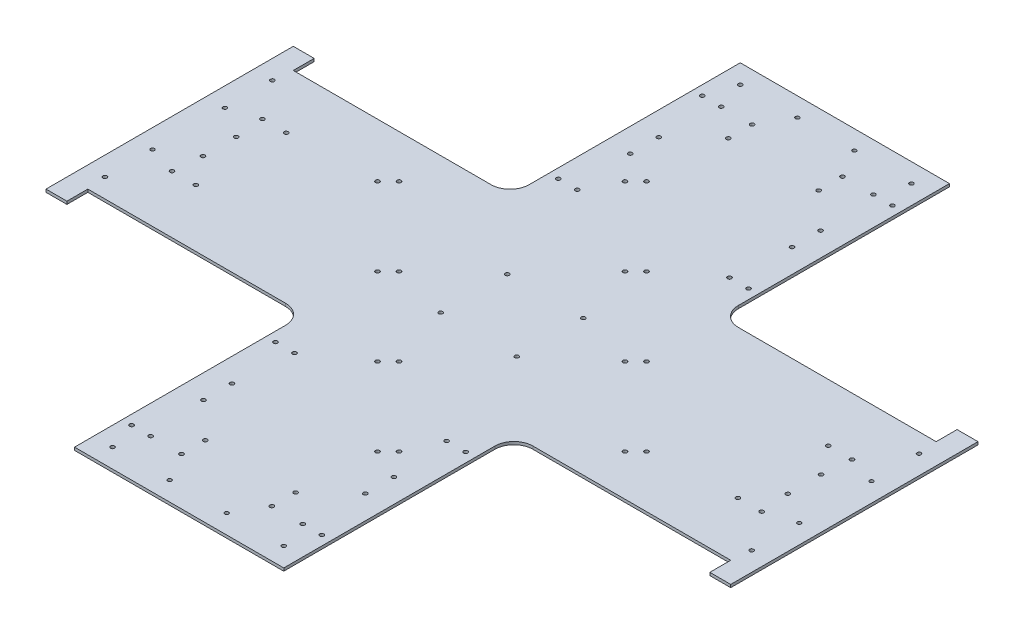
from build123d import *

# Parameters (mm, degrees)
BOSS_EXTRUDE1_DEPTH = 3
SKETCH2_R           = 2.125
CUT_EXTRUDE1_DEPTH  = 503.104570782
SKETCH3_R           = 2
CUT_EXTRUDE2_DEPTH  = 503.104570782
SKETCH5_R           = 2.125
CUT_EXTRUDE4_DEPTH  = 10
FILLET1_R           = 20
SKETCH6_R           = 2.125
CUT_EXTRUDE5_DEPTH  = 503.104570782
SKETCH8_R           = 2.1
CUT_EXTRUDE6_DEPTH  = 10
SKETCH7_R           = 2.1
CUT_EXTRUDE7_DEPTH  = 10


with BuildPart() as part:
    # Sketch1 → Boss-Extrude1 (new body)
    with BuildSketch(Plane(origin=(0, 0, 0), x_dir=(1, 0, 0), z_dir=(0, 1, 0))):
        Polygon((-110, 350), (-110, 108), (-338, 108), (-338, 130), (-360, 130), (-360, -130), (-338, -130), (-338, -108), (-110, -108), (-110, -350), (110, -350), (110, -108), (338, -108), (338, -130), (360, -130), (360, 130), (338, 130), (338, 108), (110, 108), (110, 350), align=None)
    extrude(amount=BOSS_EXTRUDE1_DEPTH)

    # Sketch2 → Cut-Extrude1 (cut, through all)
    with BuildSketch(Plane(origin=(0, 3, 0), x_dir=(1, 0, 0), z_dir=(0, 1, 0))):
        with Locations(Location((310, 47.5, 0), (0, 0, 270))):
            Circle(SKETCH2_R)
        with Locations(Location((285, 47.5, 0), (0, 0, 270))):
            Circle(SKETCH2_R)
        with Locations(Location((307.5, 17.5, 0), (0, 0, 270))):
            Circle(SKETCH2_R)
        with Locations(Location((307.5, -17.5, 0), (0, 0, 270))):
            Circle(SKETCH2_R)
        with Locations(Location((310, -47.5, 0), (0, 0, 270))):
            Circle(SKETCH2_R)
        with Locations(Location((285, -47.5, 0), (0, 0, 270))):
            Circle(SKETCH2_R)
        with Locations(Location((-285, -47.5, 0), (0, 0, 90))):
            Circle(SKETCH2_R)
        with Locations(Location((-310, -47.5, 0), (0, 0, 90))):
            Circle(SKETCH2_R)
        with Locations(Location((-307.5, -17.5, 0), (0, 0, 90))):
            Circle(SKETCH2_R)
        with Locations(Location((-307.5, 17.5, 0), (0, 0, 90))):
            Circle(SKETCH2_R)
        with Locations(Location((-285, 47.5, 0), (0, 0, 90))):
            Circle(SKETCH2_R)
        with Locations(Location((-310, 47.5, 0), (0, 0, 90))):
            Circle(SKETCH2_R)
        with Locations(Location((47.5, 300, 0), (0, 0, 270))):
            Circle(SKETCH2_R)
        with Locations(Location((47.5, 275, 0), (0, 0, 270))):
            Circle(SKETCH2_R)
        with Locations(Location((-47.5, 275, 0), (0, 0, 90))):
            Circle(SKETCH2_R)
        with Locations(Location((-47.5, 300, 0), (0, 0, 90))):
            Circle(SKETCH2_R)
        with Locations(Location((-47.5, -300, 0), (0, 0, 270))):
            Circle(SKETCH2_R)
        with Locations(Location((-47.5, -275, 0), (0, 0, 270))):
            Circle(SKETCH2_R)
        with Locations(Location((47.5, -275, 0), (0, 0, 90))):
            Circle(SKETCH2_R)
        with Locations(Location((47.5, -300, 0), (0, 0, 90))):
            Circle(SKETCH2_R)
    extrude(amount=-CUT_EXTRUDE1_DEPTH, mode=Mode.SUBTRACT)

    # Sketch3 → Cut-Extrude2 (cut, through all)
    with BuildSketch(Plane(origin=(0, 3, 0), x_dir=(1, 0, 0), z_dir=(0, 1, 0))):
        with Locations(Location((340, 38, 0), (0, 0, 270))):
            Circle(SKETCH3_R)
        with Locations(Location((340, -38, 0), (0, 0, 90))):
            Circle(SKETCH3_R)
        with Locations(Location((-340, -38, 0), (0, 0, 270))):
            Circle(SKETCH3_R)
        with Locations(Location((-340, 38, 0), (0, 0, 90))):
            Circle(SKETCH3_R)
        with Locations(Location((-30, 330, 0), (0, 0, 270))):
            Circle(SKETCH3_R)
        with Locations(Location((30, 330, 0), (0, 0, 90))):
            Circle(SKETCH3_R)
        with Locations(Location((30, -330, 0), (0, 0, 270))):
            Circle(SKETCH3_R)
        with Locations(Location((-30, -330, 0), (0, 0, 90))):
            Circle(SKETCH3_R)
    extrude(amount=-CUT_EXTRUDE2_DEPTH, mode=Mode.SUBTRACT)

    # Sketch5 → Cut-Extrude4 (cut)
    with BuildSketch(Plane(origin=(0, 3, 0), x_dir=(1, 0, 0), z_dir=(0, 1, 0))):
        with Locations(Location((80, 300, 0), (0, 0, 270))):
            Circle(SKETCH5_R)
        with Locations(Location((80, 148.73, 0), (0, 0, 270))):
            Circle(SKETCH5_R)
        with Locations(Location((85.11, 239.365, 0), (0, 0, 270))):
            Circle(SKETCH5_R)
        with Locations(Location((85.11, 209.365, 0), (0, 0, 270))):
            Circle(SKETCH5_R)
        with Locations(Location((100, 148.73, 0), (0, 0, 90))):
            Circle(SKETCH5_R)
        with Locations(Location((100, 300, 0), (0, 0, 90))):
            Circle(SKETCH5_R)
        with Locations(Location((-100, 300, 0), (0, 0, 270))):
            Circle(SKETCH5_R)
        with Locations(Location((-100, 148.73, 0), (0, 0, 270))):
            Circle(SKETCH5_R)
        with Locations(Location((-85.11, 209.365, 0), (0, 0, 90))):
            Circle(SKETCH5_R)
        with Locations(Location((-85.11, 239.365, 0), (0, 0, 90))):
            Circle(SKETCH5_R)
        with Locations(Location((-80, 148.73, 0), (0, 0, 90))):
            Circle(SKETCH5_R)
        with Locations(Location((-80, 300, 0), (0, 0, 90))):
            Circle(SKETCH5_R)
        with Locations(Location((-80, -300, 0), (0, 0, 270))):
            Circle(SKETCH5_R)
        with Locations(Location((-80, -148.73, 0), (0, 0, 270))):
            Circle(SKETCH5_R)
        with Locations(Location((-85.11, -239.365, 0), (0, 0, 270))):
            Circle(SKETCH5_R)
        with Locations(Location((-85.11, -209.365, 0), (0, 0, 270))):
            Circle(SKETCH5_R)
        with Locations(Location((-100, -148.73, 0), (0, 0, 90))):
            Circle(SKETCH5_R)
        with Locations(Location((-100, -300, 0), (0, 0, 90))):
            Circle(SKETCH5_R)
        with Locations(Location((100, -300, 0), (0, 0, 270))):
            Circle(SKETCH5_R)
        with Locations(Location((100, -148.73, 0), (0, 0, 270))):
            Circle(SKETCH5_R)
        with Locations(Location((85.11, -209.365, 0), (0, 0, 90))):
            Circle(SKETCH5_R)
        with Locations(Location((85.11, -239.365, 0), (0, 0, 90))):
            Circle(SKETCH5_R)
        with Locations(Location((80, -148.73, 0), (0, 0, 90))):
            Circle(SKETCH5_R)
        with Locations(Location((80, -300, 0), (0, 0, 90))):
            Circle(SKETCH5_R)
    extrude(amount=-CUT_EXTRUDE4_DEPTH, mode=Mode.SUBTRACT)

    # Fillet1
    fillet1_edges = [part.edges().sort_by_distance(p)[0] for p in [
        (110, 1.5, -108),
        (110, 1.5, 108),
        (-110, 1.5, 108),
        (-110, 1.5, -108),
    ]]
    fillet(fillet1_edges, radius=FILLET1_R)

    # Sketch6 → Cut-Extrude5 (cut, through all)
    with BuildSketch(Plane(origin=(0, 3, 0), x_dir=(1, 0, 0), z_dir=(0, 1, 0))):
        with Locations(Location((53.325901808, -194.747258045, 0), (0, 0, 270))):
            Circle(SKETCH6_R)
        with Locations(Location((-192.747258045, 51.325901808, 0), (0, 0, 270))):
            Circle(SKETCH6_R)
        with Locations(Location((-28.69848481, -112.722871427, 0), (0, 0, 270))):
            Circle(SKETCH6_R)
        with Locations(Location((-110.722871427, -30.69848481, 0), (0, 0, 270))):
            Circle(SKETCH6_R)
        with Locations(Location((64.639610307, -183.433549546, 0), (0, 0, 90))):
            Circle(SKETCH6_R)
        with Locations(Location((-17.384776311, -101.409162928, 0), (0, 0, 90))):
            Circle(SKETCH6_R)
        with Locations(Location((-99.409162928, -19.384776311, 0), (0, 0, 90))):
            Circle(SKETCH6_R)
        with Locations(Location((-181.433549546, 62.639610307, 0), (0, 0, 90))):
            Circle(SKETCH6_R)
        with Locations(Location((-62.639610307, 181.433549546, 0), (0, 0, 270))):
            Circle(SKETCH6_R)
        with Locations(Location((19.384776311, 99.409162928, 0), (0, 0, 270))):
            Circle(SKETCH6_R)
        with Locations(Location((101.409162928, 17.384776311, 0), (0, 0, 270))):
            Circle(SKETCH6_R)
        with Locations(Location((183.433549546, -64.639610307, 0), (0, 0, 270))):
            Circle(SKETCH6_R)
        with Locations(Location((30.69848481, 110.722871427, 0), (0, 0, 90))):
            Circle(SKETCH6_R)
        with Locations(Location((112.722871427, 28.69848481, 0), (0, 0, 90))):
            Circle(SKETCH6_R)
        with Locations(Location((-51.325901808, 192.747258045, 0), (0, 0, 90))):
            Circle(SKETCH6_R)
        with Locations(Location((194.747258045, -53.325901808, 0), (0, 0, 90))):
            Circle(SKETCH6_R)
    extrude(amount=-CUT_EXTRUDE5_DEPTH, mode=Mode.SUBTRACT)

    # Sketch8 → Cut-Extrude6 (cut)
    with BuildSketch(Plane(origin=(0, 3, 0), x_dir=(1, 0, 0), z_dir=(0, 1, 0))):
        with Locations(Location((-40, 35, 0), (0, 0, 270))):
            Circle(SKETCH8_R)
        with Locations(Location((40, 35, 0), (0, 0, 90))):
            Circle(SKETCH8_R)
        with Locations(Location((40, -35, 0), (0, 0, 270))):
            Circle(SKETCH8_R)
        with Locations(Location((-40, -35, 0), (0, 0, 90))):
            Circle(SKETCH8_R)
    extrude(amount=-CUT_EXTRUDE6_DEPTH, mode=Mode.SUBTRACT)

    # Sketch7 → Cut-Extrude7 (cut)
    with BuildSketch(Plane(origin=(0, 3, 0), x_dir=(1, 0, 0), z_dir=(0, 1, 0))):
        with Locations(Location((340, 88, 0), (0, 0, 270))):
            Circle(SKETCH7_R)
        with Locations(Location((340, -88, 0), (0, 0, 90))):
            Circle(SKETCH7_R)
        with Locations(Location((-340, -88, 0), (0, 0, 270))):
            Circle(SKETCH7_R)
        with Locations(Location((-340, 88, 0), (0, 0, 90))):
            Circle(SKETCH7_R)
        with Locations(Location((-90, 330, 0), (0, 0, 270))):
            Circle(SKETCH7_R)
        with Locations(Location((90, 330, 0), (0, 0, 90))):
            Circle(SKETCH7_R)
        with Locations(Location((90, -330, 0), (0, 0, 270))):
            Circle(SKETCH7_R)
        with Locations(Location((-90, -330, 0), (0, 0, 90))):
            Circle(SKETCH7_R)
    extrude(amount=-CUT_EXTRUDE7_DEPTH, mode=Mode.SUBTRACT)


solid = part.part
